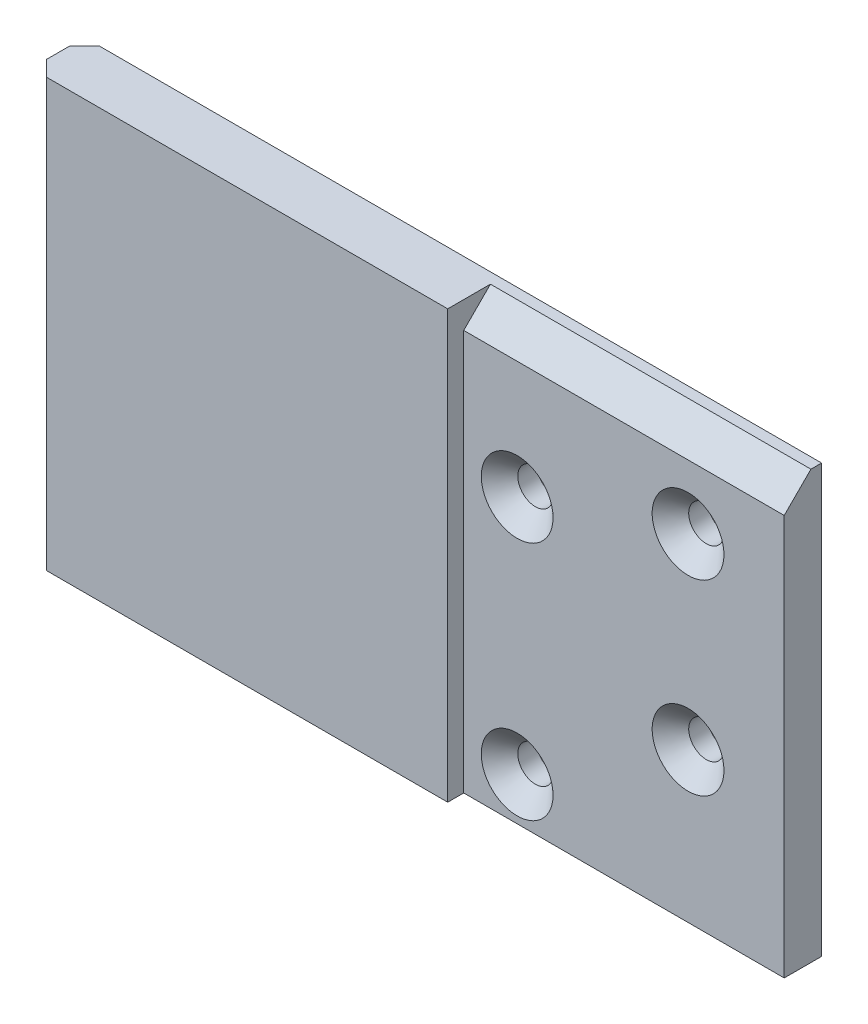
from build123d import *

# Parameters (mm, degrees)
RESSALTO_EXTRUS_O1_DEPTH                            = 80
CHANFRO2_SIZE                                       = 5
ESCAREADO_PARA_PARAFUSO_ALLEN_SEXTAVADO_D           = 6.6
ESCAREADO_PARA_PARAFUSO_ALLEN_SEXTAVADO_CSINK_D     = 13.44
ESCAREADO_PARA_PARAFUSO_ALLEN_SEXTAVADO_CSINK_ANGLE = 90


with BuildPart() as part:
    # Esboço1 → Ressalto-extrusão1 (new body)
    with BuildSketch(Plane(origin=(0, 0, 0), x_dir=(1, 0, 0), z_dir=(0, 1, 0))):
        Polygon((0, 0), (0, 7), (-135.225243436, 7), (-138, 4.225243436), (-138, -0.135644581), (-135.135644581, -3), (-60, -3), (-60, 0), align=None)
    extrude(amount=RESSALTO_EXTRUS_O1_DEPTH)

    # Chanfro2
    chanfro2_edges = [part.edges().sort_by_distance(p)[0] for p in [
        (-30, 80, 0),
    ]]
    chamfer(chanfro2_edges, length=CHANFRO2_SIZE)

    # Escareado para parafuso Allen sextavado escareado de M62 (through all)
    with Locations(Plane.XY):
        with Locations((-18, 63), (-50, 53), (-18, 28), (-50, 8)):
            CounterSinkHole(ESCAREADO_PARA_PARAFUSO_ALLEN_SEXTAVADO_D / 2, ESCAREADO_PARA_PARAFUSO_ALLEN_SEXTAVADO_CSINK_D / 2, counter_sink_angle=ESCAREADO_PARA_PARAFUSO_ALLEN_SEXTAVADO_CSINK_ANGLE)


solid = part.part
